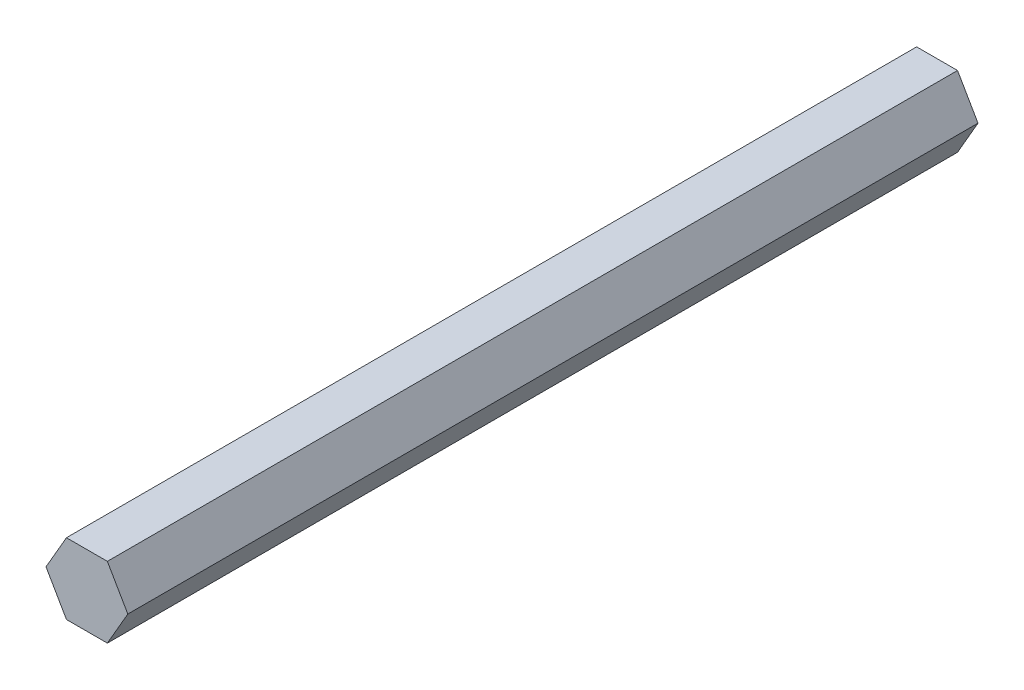
from build123d import *

# Parameters (mm, degrees)
EXTRUSI_N_HEX_PROFILE_DEPTH = 76.2


with BuildPart() as part:
    # Croquis2 → Extrusión Hex Profile (new, symmetric)
    with BuildSketch(Plane.XY):
        Polygon((3.666174209, -6.35), (7.332348419, 0), (3.666174209, 6.35), (-3.666174209, 6.35), (-7.332348419, 0), (-3.666174209, -6.35), align=None)
    extrude(amount=EXTRUSI_N_HEX_PROFILE_DEPTH, both=True)


solid = part.part
